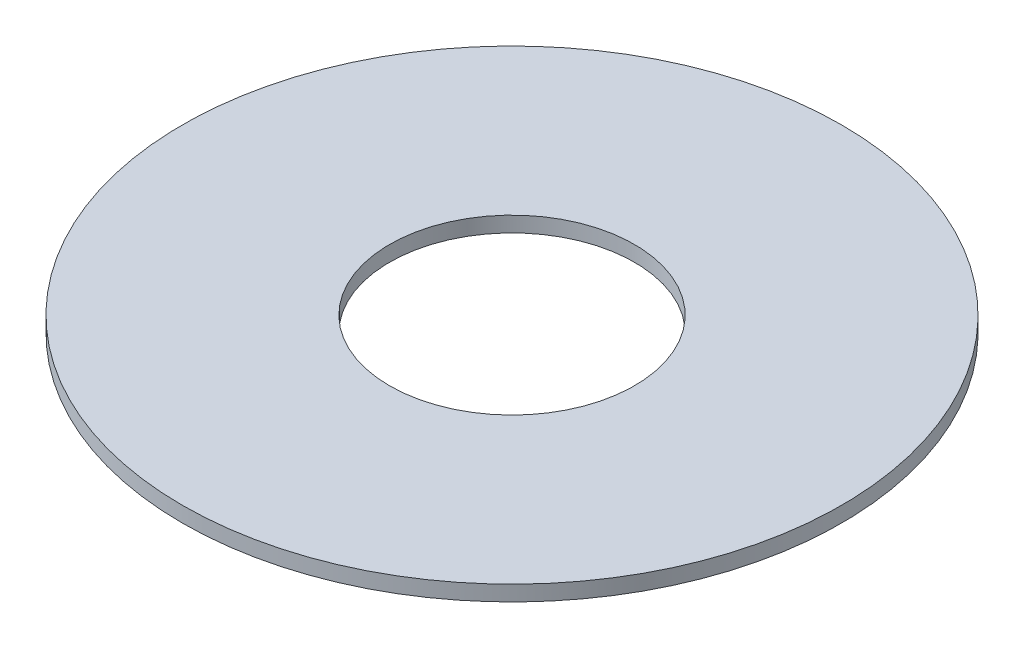
from build123d import *

# Parameters (mm, degrees)
SKETCH1_R           = 42.725
SKETCH1_R_2         = 15.875
BOSS_EXTRUDE1_DEPTH = 2


with BuildPart() as part:
    # Sketch1 → Boss-Extrude1 (new body)
    with BuildSketch(Plane(origin=(0, 0, 0), x_dir=(1, 0, 0), z_dir=(0, 1, 0))):
        with Locations(Location((0, 0, 0), (0, 0, 270))):
            Circle(SKETCH1_R)
        with Locations(Location((0, 0, 0), (0, 0, 270))):
            Circle(SKETCH1_R_2, mode=Mode.SUBTRACT)
    extrude(amount=BOSS_EXTRUDE1_DEPTH)


solid = part.part
